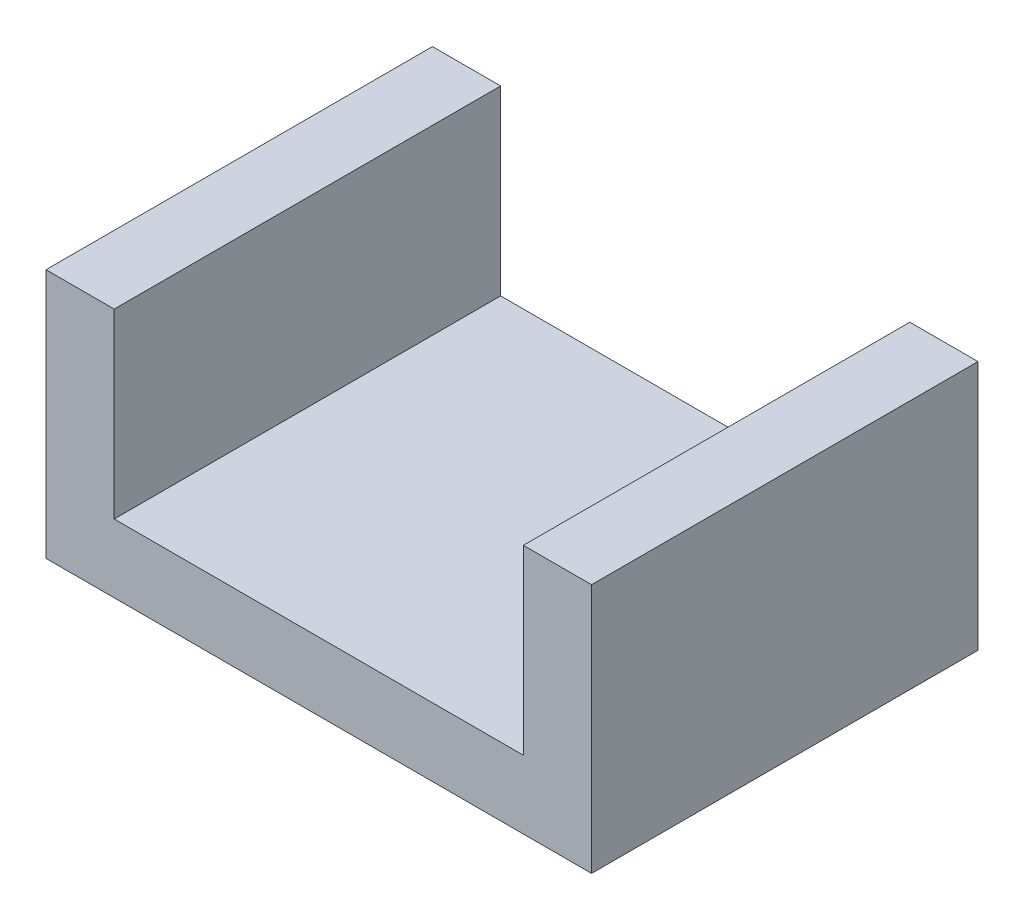
from build123d import *

# Parameters (mm, degrees)
RESSALTO_EXTRUS_O1_DEPTH = 17


with BuildPart() as part:
    # Esboço1 → Ressalto-extrusão1 (new body)
    with BuildSketch(Plane.XY):
        Polygon((-9.995430311, 0), (-9.995430311, 7.998136662), (-12.995430311, 7.998136662), (-12.995430311, -3.001863338), (11.004569689, -3.001863338), (11.004569689, 7.998136662), (8.004569689, 7.998136662), (8.004569689, 0), align=None)
    extrude(amount=-RESSALTO_EXTRUS_O1_DEPTH)


solid = part.part
